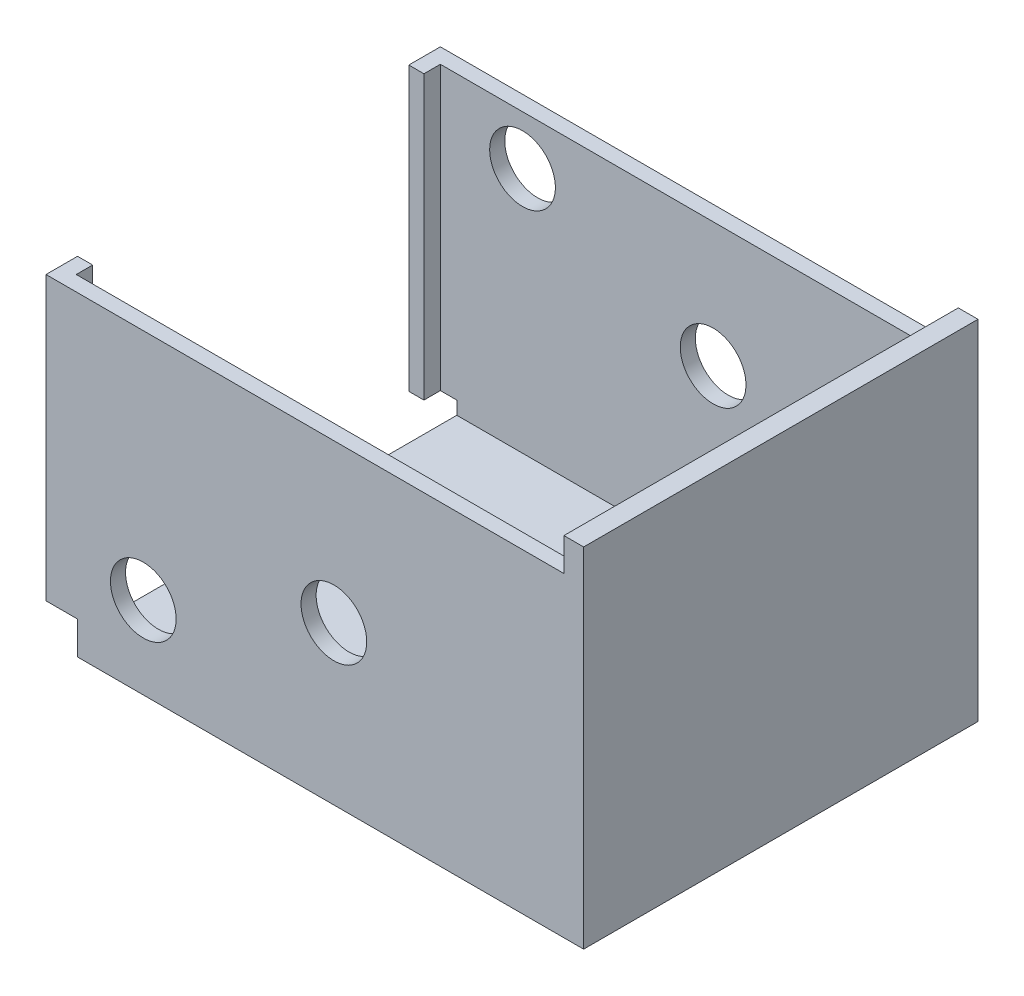
from build123d import *

# Parameters (mm, degrees)
ESQUISSE1_W             = 77
ESQUISSE1_H             = 60
BOSS_EXTRU_1_DEPTH      = 3
BOSS_EXTRU_2_DEPTH      = 50
ESQUISSE3_W             = 55.4
ESQUISSE3_H             = 3
BOSS_EXTRU_3_DEPTH      = 74
ENL_V_MAT_EXTRU_2_REACH = 113.077
ESQUISSE5_R             = 5
BOSS_EXTRU_5_DEPTH      = 48
ENL_V_MAT_EXTRU_3_REACH = 113.077
ESQUISSE8_W             = 5
ESQUISSE8_H             = 10
ENL_V_MAT_EXTRU_4_DEPTH = 5
ESQUISSE10_R            = 5
ENL_V_MAT_EXTRU_5_DEPTH = 3
ESQUISSE11_W            = 74
ESQUISSE11_H            = 60
ENL_V_MAT_EXTRU_6_DEPTH = 5


with BuildPart() as part:
    # Esquisse1 → Boss.-Extru.1 (new body)
    with BuildSketch(Plane(origin=(0, 0, 0), x_dir=(1, 0, 0), z_dir=(0, 1, 0))):
        with Locations((38.5, 30)):
            Rectangle(ESQUISSE1_W, ESQUISSE1_H)
    extrude(amount=BOSS_EXTRU_1_DEPTH)

    # Esquisse2 → Boss.-Extru.2 (add)
    with BuildSketch(Plane(origin=(0, 3, 0), x_dir=(1, 0, 0), z_dir=(0, 1, 0))):
        Polygon((0, 60), (77, 60), (77, 0), (0, 0), (0, 2.3), (74, 2.3), (74, 57.7), (0, 57.7), align=None)
    extrude(amount=BOSS_EXTRU_2_DEPTH)

    # Esquisse3 → Boss.-Extru.3 (add)
    with BuildSketch(Plane.ZY.offset(-74)):
        with Locations((-30, 51.5)):
            Rectangle(ESQUISSE3_W, ESQUISSE3_H)
    extrude(amount=BOSS_EXTRU_3_DEPTH)

    # Esquisse5 → Enlèv. mat.-Extru.2 (cut, up to next)
    with BuildSketch(Plane(origin=(0, 0, -60), x_dir=(-1, 0, 0), z_dir=(0, 0, -1)), mode=Mode.PRIVATE) as enl_v_mat_extru_2_sk1:
        with Locations((-39, 29)):
            Circle(ESQUISSE5_R)
    enl_v_mat_extru_2_tool1 = extrude(enl_v_mat_extru_2_sk1.sketch, amount=-ENL_V_MAT_EXTRU_2_REACH, mode=Mode.PRIVATE) & part.part
    # Esquisse5 → Enlèv. mat.-Extru.2 (cut, up to next)
    with BuildSketch(Plane(origin=(0, 0, -60), x_dir=(-1, 0, 0), z_dir=(0, 0, -1)), mode=Mode.PRIVATE) as enl_v_mat_extru_2_sk2:
        with Locations((-10, 40.5)):
            Circle(ESQUISSE5_R)
    enl_v_mat_extru_2_tool2 = extrude(enl_v_mat_extru_2_sk2.sketch, amount=-ENL_V_MAT_EXTRU_2_REACH, mode=Mode.PRIVATE) & part.part
    add(enl_v_mat_extru_2_tool1.solids().sort_by_distance((39, 29, -60))[0], mode=Mode.SUBTRACT)
    add(enl_v_mat_extru_2_tool2.solids().sort_by_distance((10, 40.5, -60))[0], mode=Mode.SUBTRACT)

    # Esquisse7 → Boss.-Extru.5 (add)
    with BuildSketch(Plane.XZ):
        Polygon((0, 0), (-4.8, 0), (-4.8, -4.8), (-2.5, -4.8), (-2.5, -2.3), (0, -2.3), align=None)
        Polygon((0, -57.7), (0, -60), (-4.8, -60), (-4.8, -55.2), (-2.5, -55.2), (-2.5, -57.7), align=None)
    extrude(amount=-BOSS_EXTRU_5_DEPTH)

    # Esquisse8 → Enlèv. mat.-Extru.3 (cut, up to next)
    with BuildSketch(Plane(origin=(0, 53, 0), x_dir=(1, 0, 0), z_dir=(0, 1, 0)), mode=Mode.PRIVATE) as enl_v_mat_extru_3_sk1:
        with Locations((2.5, 30)):
            Rectangle(ESQUISSE8_W, ESQUISSE8_H)
    enl_v_mat_extru_3_tool1 = extrude(enl_v_mat_extru_3_sk1.sketch, amount=-ENL_V_MAT_EXTRU_3_REACH, mode=Mode.PRIVATE) & part.part
    add(enl_v_mat_extru_3_tool1.solids().sort_by_distance((2.5, 53, -30))[0], mode=Mode.SUBTRACT)

    # Esquisse9 → Enlèv. mat.-Extru.4 (cut)
    with BuildSketch(Plane.XZ):
        Polygon((0, -2.3), (-2.5, -2.3), (-2.5, -4.8), (-4.8, -4.8), (-4.8, 0), (0, 0), align=None)
        Polygon((0, -60), (0, -57.7), (-2.5, -57.7), (-2.5, -55.2), (-4.8, -55.2), (-4.8, -60), align=None)
    extrude(amount=-ENL_V_MAT_EXTRU_4_DEPTH, mode=Mode.SUBTRACT)

    # Esquisse10 → Enlèv. mat.-Extru.5 (cut)
    with BuildSketch(Plane.XY):
        with Locations((10, 12.5)):
            Circle(ESQUISSE10_R)
        with Locations((39, 24)):
            Circle(ESQUISSE10_R)
    extrude(amount=-ENL_V_MAT_EXTRU_5_DEPTH, mode=Mode.SUBTRACT)

    # Esquisse11 → Enlèv. mat.-Extru.6 (cut)
    with BuildSketch(Plane(origin=(0, 53, 0), x_dir=(1, 0, 0), z_dir=(0, 1, 0))):
        with Locations((37, 30)):
            Rectangle(ESQUISSE11_W, ESQUISSE11_H)
    extrude(amount=-ENL_V_MAT_EXTRU_6_DEPTH, mode=Mode.SUBTRACT)


solid = part.part
